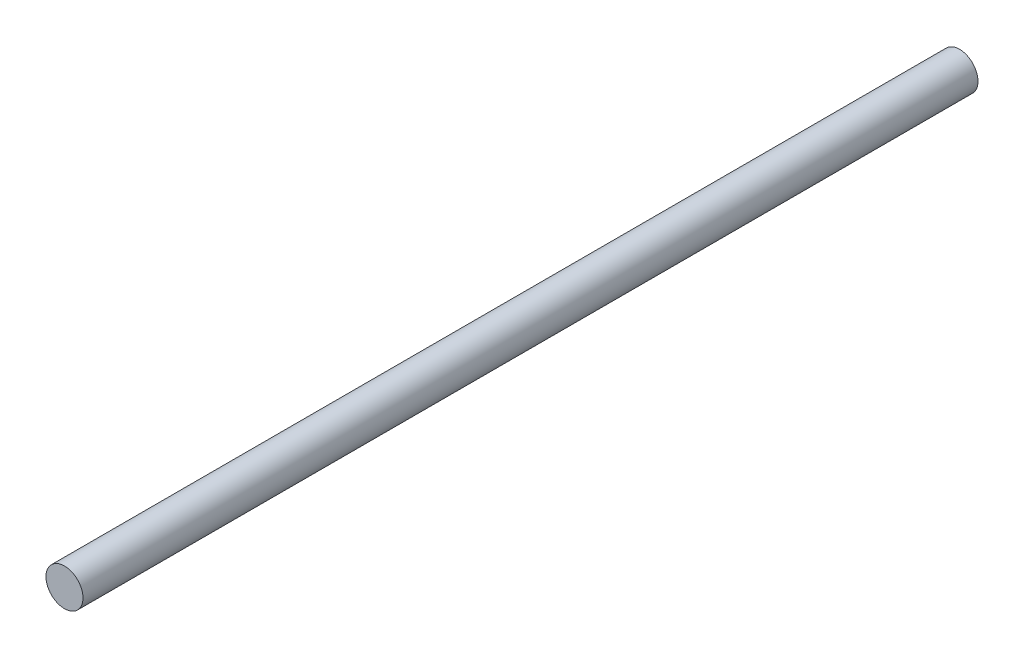
from build123d import *

# Parameters (mm, degrees)
SKETCH_1_R  = 6
CABLE_DEPTH = 290


with BuildPart() as part:
    # 草图1 → Cable (new body)
    with BuildSketch(Plane.XY):
        Circle(SKETCH_1_R)
    extrude(amount=CABLE_DEPTH)


solid = part.part
